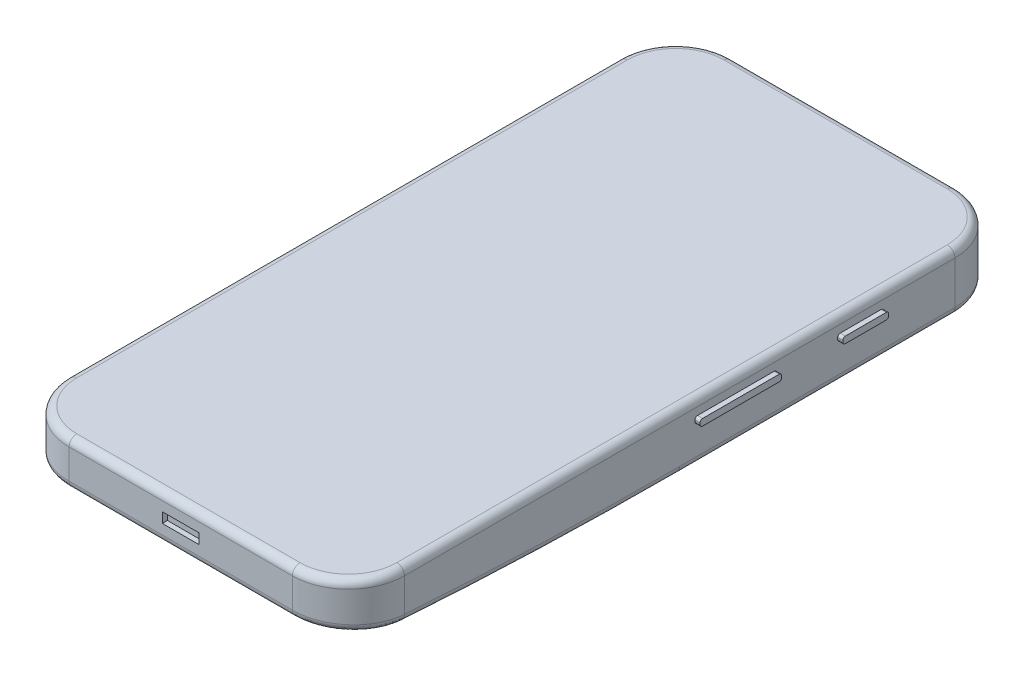
from build123d import *

# Parameters (mm, degrees)
SKETCH1_W           = 65.8
SKETCH1_H           = 130
BOSS_EXTRUDE1_DEPTH = 11.4
CUT_EXTRUDE1_DEPTH  = 94.191201301
FILLET1_R           = 11
SKETCH3_R           = 5.5
SKETCH3_R_2         = 2.75
CUT_EXTRUDE2_DEPTH  = 1
SKETCH4_W           = 16
SKETCH4_H           = 1.3
SKETCH4_W_2         = 9
BOSS_EXTRUDE2_DEPTH = 1
SKETCH5_W           = 7.2
SKETCH5_H           = 2
CUT_EXTRUDE3_DEPTH  = 1
FILLET2_R           = 0.5
FILLET3_R           = 1.5


with BuildPart() as part:
    # Sketch1 → Boss-Extrude1 (new body)
    with BuildSketch(Plane(origin=(0, 0, 0), x_dir=(1, 0, 0), z_dir=(0, 1, 0))):
        Rectangle(SKETCH1_W, SKETCH1_H)
    extrude(amount=BOSS_EXTRUDE1_DEPTH)

    # Sketch2 → Cut-Extrude1 (cut, through all)
    with BuildSketch(Plane(origin=(32.9, 0, 0), x_dir=(0, 0, -1), z_dir=(1, 0, 0))):
        with BuildLine():
            Line((-65, 2.7), (-65, 0))
            Line((-65, 0), (0, 0))
            ThreePointArc((0, 0), (-32.528026377, 0.675290918), (-65, 2.7))
        make_face()
    extrude(amount=-CUT_EXTRUDE1_DEPTH, mode=Mode.SUBTRACT)

    # Fillet1
    fillet1_edges = [part.edges().sort_by_distance(p)[0] for p in [
        (32.9, 7.05, 65),
        (-32.9, 7.05, 65),
        (-32.9, 5.7, -65),
        (32.9, 5.7, -65),
    ]]
    fillet(fillet1_edges, radius=FILLET1_R)

    # Sketch3 → Cut-Extrude2 (cut)
    with BuildSketch(Plane.XZ):
        with Locations(Location((0, -44.1, 0), (0, 0, 270))):
            Circle(SKETCH3_R)
        with Locations(Location((0, -30.7, 0), (0, 0, 270))):
            Circle(SKETCH3_R_2)
    extrude(amount=-CUT_EXTRUDE2_DEPTH, mode=Mode.SUBTRACT)

    # Sketch4 → Boss-Extrude2 (add)
    with BuildSketch(Plane(origin=(32.9, 0, 0), x_dir=(0, 0, -1), z_dir=(1, 0, 0))):
        with Locations((11, 7.75)):
            Rectangle(SKETCH4_W, SKETCH4_H)
        with Locations((35.5, 7.75)):
            Rectangle(SKETCH4_W_2, SKETCH4_H)
    extrude(amount=BOSS_EXTRUDE2_DEPTH)

    # Sketch5 → Cut-Extrude3 (cut)
    with BuildSketch(Plane.XY.offset(65)):
        with Locations((0, 7.05)):
            Rectangle(SKETCH5_W, SKETCH5_H)
    extrude(amount=-CUT_EXTRUDE3_DEPTH, mode=Mode.SUBTRACT)

    # Fillet2
    fillet2_edges = [part.edges().sort_by_distance(p)[0] for p in [
        (33.4, 7.1, -19),
        (33.4, 8.4, -19),
        (33.4, 8.4, -3),
        (33.4, 7.1, -3),
        (33.4, 7.1, -40),
        (33.4, 8.4, -40),
        (33.4, 8.4, -31),
        (33.4, 7.1, -31),
    ]]
    fillet(fillet2_edges, radius=FILLET2_R)

    # Fillet3
    fillet3_edges = [part.edges().sort_by_distance(p)[0] for p in [
        (32.9, 0, -27),
        (-32.9, 0.465759006, 27.016054675),
        (32.9, 0.465759006, 27.016054675),
        (-32.9, 0, -27),
        (-32.9, 11.4, 0),
        (0, 0, -65),
        (29.678174593, 0, -61.778174593),
        (-29.678174593, 0, -61.778174593),
        (0, 11.4, -65),
        (32.9, 11.4, 0),
        (0, 11.4, 65),
        (-29.678174593, 11.4, 61.778174593),
        (29.678174593, 11.4, 61.778174593),
        (29.678174593, 11.4, -61.778174593),
        (-29.678174593, 11.4, -61.778174593),
        (0, 2.7, 65),
        (-29.683166447, 2.438171783, 61.773179536),
        (29.683166447, 2.438171783, 61.773179536),
    ]]
    fillet(fillet3_edges, radius=FILLET3_R)


solid = part.part
